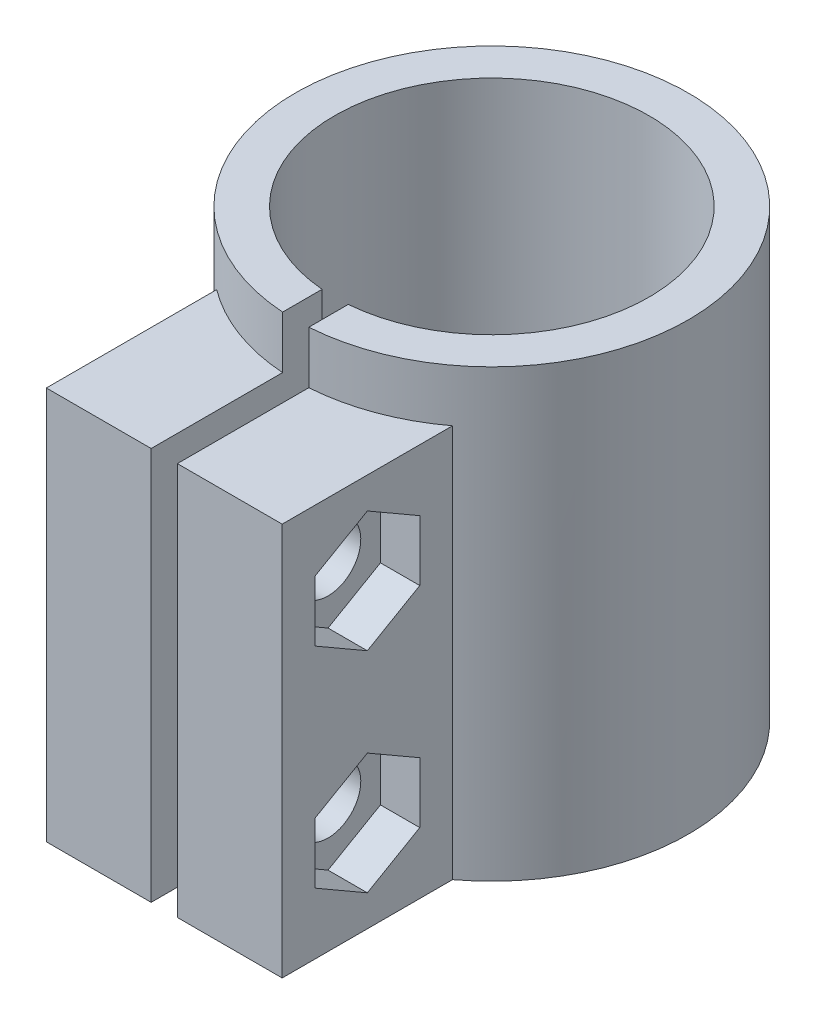
from build123d import *

# Parameters (mm, degrees)
SKETCH_1_R                  = 7.5
SKETCH_1_R_2                = 6
EXTRUDE_1_DEPTH             = 17
CUT_EXTRUDE_1_REACH         = 25.88
CUT_EXTRUDE_1_END_RADIUS    = 6
SKETCH_2_W                  = 1
SKETCH_2_H                  = 17
SKETCH_3_W                  = 4
SKETCH_3_H                  = 17
EXTRUDE_2_DEPTH             = 5
EXTRUDE_2_DIRECTION_2_REACH = 25.88
CUT_EXTRUDE_START           = -2
CUT_EXTRUDE_4_DEPTH         = 2
CUT_EXTRUDE_2_REACH         = 26.274
SKETCH_4_R                  = 1.25
CUT_EXTRUDE_3_DEPTH         = 1.5


with BuildPart() as part:
    # 草图1 → 凸台-拉伸1 (new body)
    with BuildSketch(Plane(origin=(0, 0, 0), x_dir=(1, 0, 0), z_dir=(0, 1, 0))):
        with Locations(Location((0, 0, 0), (0, 0, 270))):
            Circle(SKETCH_1_R)
        with Locations(Location((0, 0, 0), (0, 0, 270))):
            Circle(SKETCH_1_R_2, mode=Mode.SUBTRACT)
    extrude(amount=EXTRUDE_1_DEPTH)

    # 切除-拉伸1: up to this cylinder (the profile starts outside it)
    cut_extrude_1_end = Plane(origin=(0, 8.5, 0), z_dir=(0, -1, 0)) * Cylinder(CUT_EXTRUDE_1_END_RADIUS, 64.76, mode=Mode.PRIVATE)
    # 草图2 → 切除-拉伸1 (cut, up to the surface)
    with BuildSketch(Plane.XY.offset(7.5), mode=Mode.PRIVATE) as cut_extrude_1_sk1:
        with Locations((0, 8.5)):
            Rectangle(SKETCH_2_W, SKETCH_2_H)
    cut_extrude_1_tool1 = extrude(cut_extrude_1_sk1.sketch, amount=-CUT_EXTRUDE_1_REACH, mode=Mode.PRIVATE) - cut_extrude_1_end
    add(cut_extrude_1_tool1.solids().sort_by_distance((0, 8.5, 7.5))[0], mode=Mode.SUBTRACT)

    # 草图3 → 凸台-拉伸2 (add)
    with BuildSketch(Plane.XY.offset(7.5)):
        with Locations((-2.5, 8.5)):
            Rectangle(SKETCH_3_W, SKETCH_3_H)
        with Locations((2.5, 8.5)):
            Rectangle(SKETCH_3_W, SKETCH_3_H)
    extrude(amount=EXTRUDE_2_DEPTH)

    # 草图3 → 凸台-拉伸2 direction 2 (add, up to next)
    with BuildSketch(Plane.XY.offset(7.5), mode=Mode.PRIVATE) as extrude_2_direction_2_sk1:
        with Locations((-2.5, 8.5)):
            Rectangle(SKETCH_3_W, SKETCH_3_H)
    extrude_2_direction_2_tool1 = extrude(extrude_2_direction_2_sk1.sketch, amount=-EXTRUDE_2_DIRECTION_2_REACH, mode=Mode.PRIVATE) - part.part
    # 草图3 → 凸台-拉伸2 direction 2 (add, up to next)
    with BuildSketch(Plane.XY.offset(7.5), mode=Mode.PRIVATE) as extrude_2_direction_2_sk2:
        with Locations((2.5, 8.5)):
            Rectangle(SKETCH_3_W, SKETCH_3_H)
    extrude_2_direction_2_tool2 = extrude(extrude_2_direction_2_sk2.sketch, amount=-EXTRUDE_2_DIRECTION_2_REACH, mode=Mode.PRIVATE) - part.part
    add(extrude_2_direction_2_tool1.solids().sort_by_distance((-2.5, 8.5, 7.5))[0])
    add(extrude_2_direction_2_tool2.solids().sort_by_distance((2.5, 8.5, 7.5))[0])

    # 草图7 → 切除-拉伸4 (cut)
    with BuildSketch(Plane(origin=(0, 17, 0), x_dir=(1, 0, 0), z_dir=(0, 1, 0)).offset(CUT_EXTRUDE_START)):
        with BuildLine():
            Line((-4.5, -6), (-4.5, -12.5))
            Line((-4.5, -12.5), (4.5, -12.5))
            Line((4.5, -12.5), (4.5, -6))
            ThreePointArc((4.5, -6), (0, -7.5), (-4.5, -6))
        make_face()
    extrude(amount=CUT_EXTRUDE_4_DEPTH, mode=Mode.SUBTRACT)

    # 切除-拉伸2: up to this face of the body (flat: up to its plane)
    cut_extrude_2_end = Plane(part.part.faces().sort_by_distance((4.5, 7.5, 9.25))[0])
    # 草图4 → 切除-拉伸2 (cut, up to the picked face)
    with BuildSketch(Plane.ZY.offset(4.5), mode=Mode.PRIVATE) as cut_extrude_2_sk1:
        with Locations(Location((9.25, 11.5, 0), (0, 0, 270))):
            Circle(SKETCH_4_R)
    cut_extrude_2_tool1 = split(extrude(cut_extrude_2_sk1.sketch, amount=-CUT_EXTRUDE_2_REACH, mode=Mode.PRIVATE), bisect_by=cut_extrude_2_end, keep=Keep.BOTH, mode=Mode.PRIVATE)
    # 草图4 → 切除-拉伸2 (cut, up to the picked face)
    with BuildSketch(Plane.ZY.offset(4.5), mode=Mode.PRIVATE) as cut_extrude_2_sk2:
        with Locations(Location((9.25, 3.5, 0), (0, 0, 270))):
            Circle(SKETCH_4_R)
    cut_extrude_2_tool2 = split(extrude(cut_extrude_2_sk2.sketch, amount=-CUT_EXTRUDE_2_REACH, mode=Mode.PRIVATE), bisect_by=cut_extrude_2_end, keep=Keep.BOTH, mode=Mode.PRIVATE)
    add(cut_extrude_2_tool1.solids().sort_by(Axis((-4.5, 11.5, 9.25), (1, 0, 0)))[0], mode=Mode.SUBTRACT)
    add(cut_extrude_2_tool2.solids().sort_by(Axis((-4.5, 3.5, 9.25), (1, 0, 0)))[0], mode=Mode.SUBTRACT)

    # 草图5 → 切除-拉伸3 (cut)
    with BuildSketch(Plane(origin=(4.5, 0, 0), x_dir=(0, 0, -1), z_dir=(1, 0, 0))):
        Polygon((-9.25, 9.190598923), (-7.25, 10.345299462), (-7.25, 12.654700538), (-9.25, 13.809401077), (-11.25, 12.654700538), (-11.25, 10.345299462), align=None)
        Polygon((-9.25, 1.190598923), (-7.25, 2.345299462), (-7.25, 4.654700538), (-9.25, 5.809401077), (-11.25, 4.654700538), (-11.25, 2.345299462), align=None)
    extrude(amount=-CUT_EXTRUDE_3_DEPTH, mode=Mode.SUBTRACT)


solid = part.part
